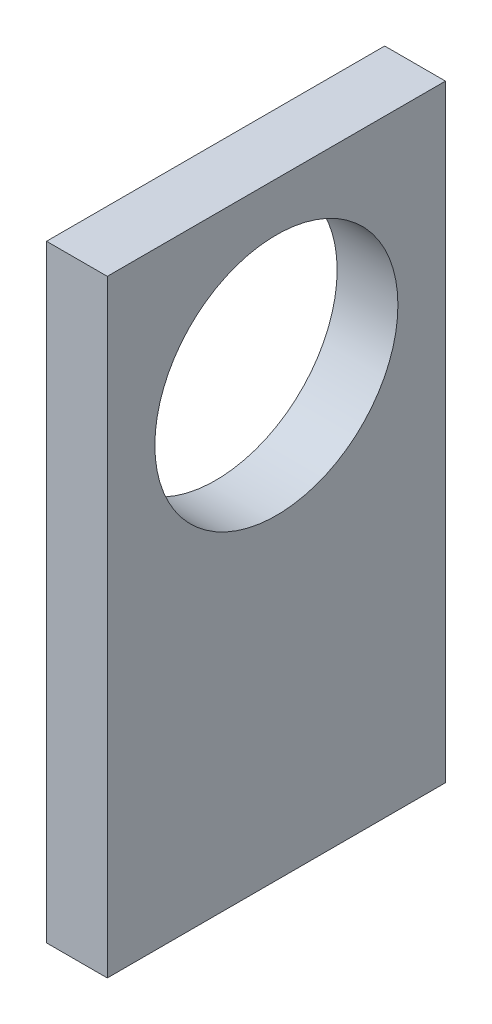
from build123d import *

# Parameters (mm, degrees)
SKETCH1_W           = 35.339607518
SKETCH1_H           = 63.5
SKETCH1_R           = 12.7
BOSS_EXTRUDE1_DEPTH = 6.35


with BuildPart() as part:
    # Sketch1 → Boss-Extrude1 (new body)
    with BuildSketch(Plane(origin=(0, 0, 0), x_dir=(0, 0, -1), z_dir=(1, 0, 0))):
        with Locations((0, -13.97)):
            Rectangle(SKETCH1_W, SKETCH1_H)
        Circle(SKETCH1_R, mode=Mode.SUBTRACT)
    extrude(amount=BOSS_EXTRUDE1_DEPTH)


solid = part.part
